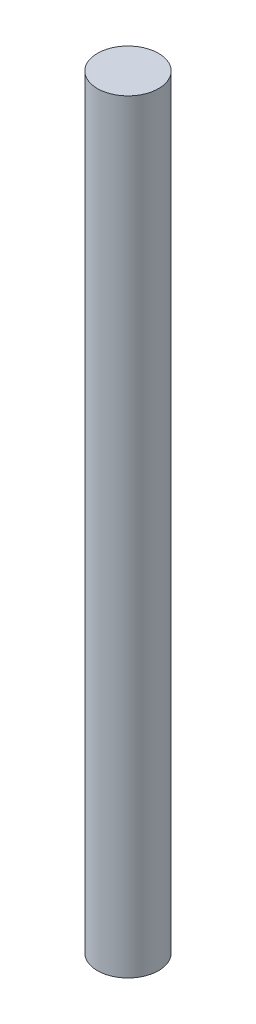
from build123d import *

# Parameters (mm, degrees)
CROQUIS1_R              = 10
SALIENTE_EXTRUIR1_DEPTH = 250


with BuildPart() as part:
    # Croquis1 → Saliente-Extruir1 (new body)
    with BuildSketch(Plane(origin=(0, 0, 0), x_dir=(1, 0, 0), z_dir=(0, 1, 0))):
        with Locations(Location((0, 0, 0), (0, 0, 270))):
            Circle(CROQUIS1_R)
    extrude(amount=SALIENTE_EXTRUIR1_DEPTH)


solid = part.part
